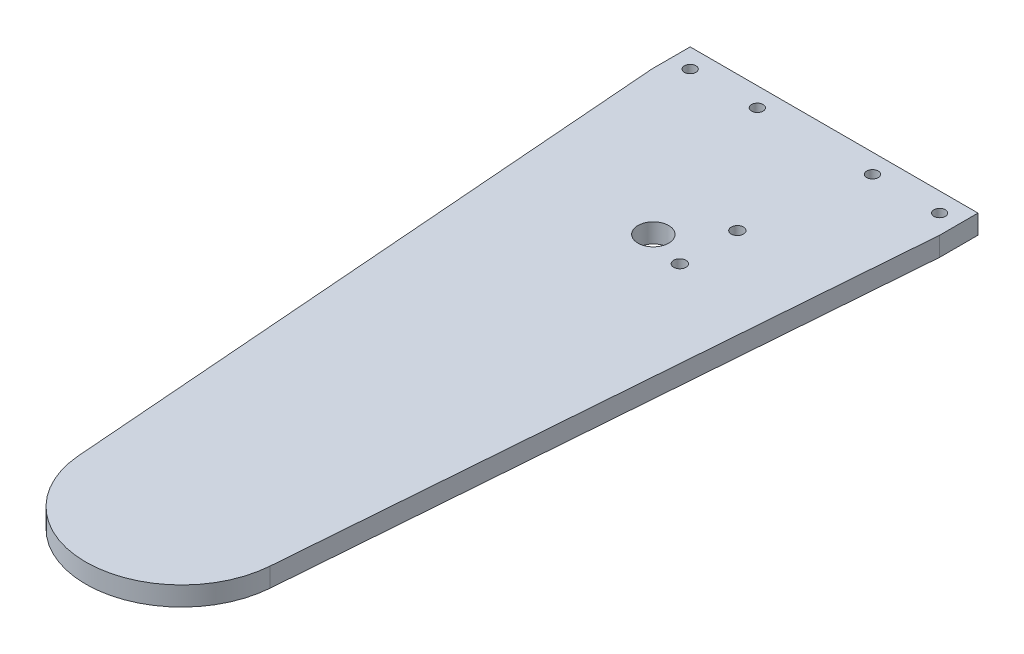
from build123d import *

# Parameters (mm, degrees)
SKETCH_1_R      = 1.5
SKETCH_1_R_2    = 4
SKETCH_1_R_3    = 1.6
EXTRUDE_1_DEPTH = 5


with BuildPart() as part:
    # ｽｹｯﾁ1 → ﾎﾞｽ - 押し出し1 (new body)
    with BuildSketch(Plane(origin=(0, 0, 0), x_dir=(1, 0, 0), z_dir=(0, 1, 0))):
        with BuildLine():
            Line((0, 0), (0, -10))
            Line((0, -10), (12.575038747, -171.935537794))
            ThreePointArc((12.575038747, -171.935537794), (37.5, -195), (62.424961253, -171.935537794))
            Line((62.424961253, -171.935537794), (75, -10))
            Line((75, -10), (75, 0))
            Line((75, 0), (0, 0))
        make_face()
        with Locations(Location((5, -5, 0), (0, 0, 270))):
            Circle(SKETCH_1_R, mode=Mode.SUBTRACT)
        with Locations(Location((70, -5, 0), (0, 0, 90))):
            Circle(SKETCH_1_R, mode=Mode.SUBTRACT)
        with Locations(Location((22.5, -5, 0), (0, 0, 270))):
            Circle(SKETCH_1_R, mode=Mode.SUBTRACT)
        with Locations(Location((52.5, -5, 0), (0, 0, 90))):
            Circle(SKETCH_1_R, mode=Mode.SUBTRACT)
        with Locations(Location((37.5, -47.1, 0), (0, 0, 270))):
            Circle(SKETCH_1_R_2, mode=Mode.SUBTRACT)
        with Locations(Location((47.6, -35.3, 0), (0, 0, 270))):
            Circle(SKETCH_1_R_3, mode=Mode.SUBTRACT)
        with Locations(Location((47.6, -50.3, 0), (0, 0, 270))):
            Circle(SKETCH_1_R_3, mode=Mode.SUBTRACT)
    extrude(amount=EXTRUDE_1_DEPTH)


solid = part.part
